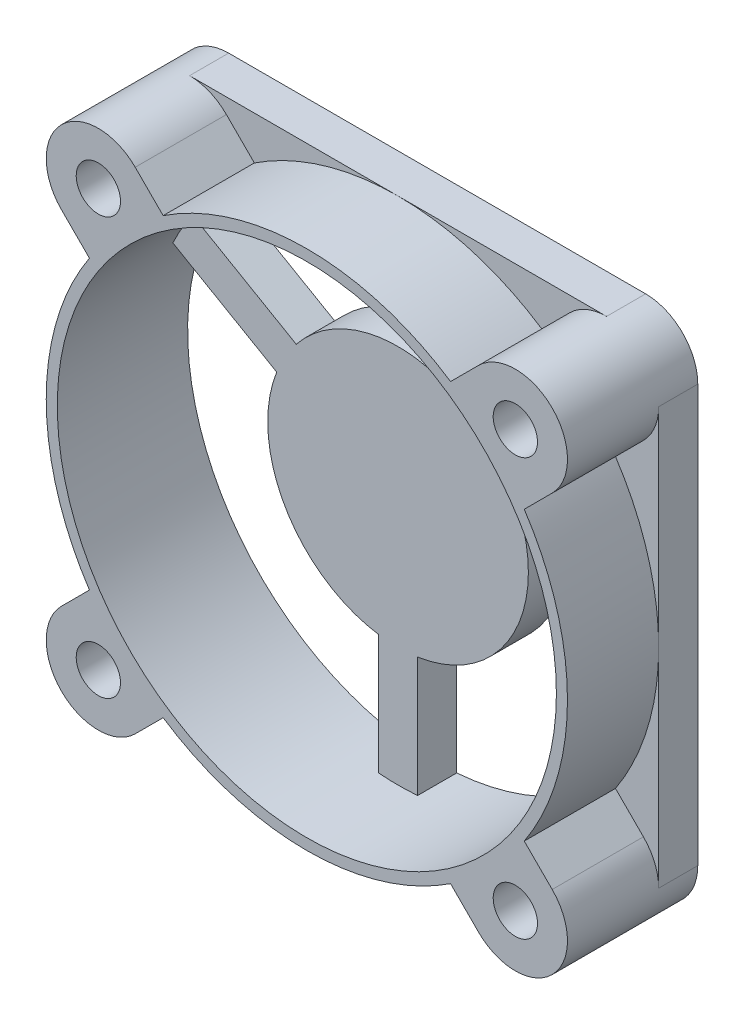
from build123d import *

# Parameters (mm, degrees)
SKETCH_BODY_R                       = 19.15
BODY_DEPTH                          = 10
SKETCH_CUT_BODY_W                   = 7
SKETCH_CUT_BODY_H                   = 6.627416998
REINFORCMENT_STRIP_DEPTH            = 10
CIRPATTERN_REINFORCMENT_STRIP_COUNT = 4
SKETCH_FIXING_HOLE_R                = 1.7
FIXING_HOLE_DEPTH                   = 31
CIRPATTERN_FIXING_HOLE_COUNT        = 4
BONE_DEPTH                          = 3
CIRPATTERN_BONE_COUNT               = 3
SKETCH_FIXING_PLATE_FAN_R           = 10
FIXING_PLATE_FAN_DEPTH              = 3


with BuildPart() as part:
    # Sketch-Body → Body (new body)
    with BuildSketch(Plane.XY):
        with BuildLine():
            Line((-16, -20), (16, -20))
            ThreePointArc((16, -20), (18.828427125, -18.828427125), (20, -16))
            Line((20, -16), (20, 16))
            ThreePointArc((20, 16), (18.828427125, 18.828427125), (16, 20))
            Line((16, 20), (-16, 20))
            ThreePointArc((-16, 20), (-18.828427125, 18.828427125), (-20, 16))
            Line((-20, 16), (-20, -16))
            ThreePointArc((-20, -16), (-18.828427125, -18.828427125), (-16, -20))
        make_face()
        with Locations(Location((0, 0, 0), (0, 0, 180))):
            Circle(SKETCH_BODY_R, mode=Mode.SUBTRACT)
    extrude(amount=BODY_DEPTH)

    # Sketch-Cut-Body → Cut-Body (revolve, cut)
    with BuildSketch(Plane(origin=(0, 0, 0), x_dir=(0, 0, -1), z_dir=(1, 0, 0)), mode=Mode.PRIVATE) as cut_body_sk:
        with Locations((-6.5, 23.313708499)):
            Rectangle(SKETCH_CUT_BODY_W, SKETCH_CUT_BODY_H)
    revolve(cut_body_sk.sketch.rotate(Axis((0, 0, 10), (0, 0, -1)), 90), axis=Axis((0, 0, 10), (0, 0, -1)), mode=Mode.SUBTRACT)

    # Sketch-Reinforcment-Strip → Reinforcment-Strip (add)
    with BuildSketch(Plane.XY):
        with BuildLine():
            Line((16.684833585, 11.027979336), (18.828427125, 13.171572875))
            ThreePointArc((18.828427125, 13.171572875), (18.828427125, 18.828427125), (13.171572875, 18.828427125))
            Line((13.171572875, 18.828427125), (11.027979336, 16.684833585))
            ThreePointArc((11.027979336, 16.684833585), (14.142135624, 14.142135624), (16.684833585, 11.027979336))
        make_face()
    reinforcment_strip = extrude(amount=REINFORCMENT_STRIP_DEPTH)

    # CirPattern-Reinforcment-Strip: Reinforcment-Strip ×4 about axis
    cirpattern_reinforcment_strip_axis = Axis((0, 0, 0), (0, 0, 1))
    for i in range(1, CIRPATTERN_REINFORCMENT_STRIP_COUNT):
        add(reinforcment_strip.rotate(cirpattern_reinforcment_strip_axis, i * 360 / CIRPATTERN_REINFORCMENT_STRIP_COUNT))

    # Sketch-Fixing-Hole → Fixing-Hole (cut, through all)
    with BuildSketch(Plane.XY):
        with Locations((16, 16)):
            Circle(SKETCH_FIXING_HOLE_R)
    fixing_hole = extrude(amount=FIXING_HOLE_DEPTH, mode=Mode.SUBTRACT)

    # CirPattern-Fixing-Hole: Fixing-Hole ×4 about axis
    cirpattern_fixing_hole_axis = Axis((0, 0, 0), (0, 0, 1))
    for i in range(1, CIRPATTERN_FIXING_HOLE_COUNT):
        add(fixing_hole.rotate(cirpattern_fixing_hole_axis, i * 360 / CIRPATTERN_FIXING_HOLE_COUNT), mode=Mode.SUBTRACT)

    # Sketch-Bone → Bone (add)
    with BuildSketch(Plane.XY):
        with BuildLine():
            Line((1.5, -9.886859967), (1.5, -19.091162877))
            ThreePointArc((1.5, -19.091162877), (0, -19.15), (-1.5, -19.091162877))
            Line((-1.5, -19.091162877), (-1.5, -9.886859967))
            ThreePointArc((-1.5, -9.886859967), (0, -10), (1.5, -9.886859967))
        make_face()
    bone = extrude(amount=BONE_DEPTH)

    # CirPattern-Bone: Bone ×3 about axis
    cirpattern_bone_axis = Axis((0, 0, 0), (0, 0, 1))
    for i in range(1, CIRPATTERN_BONE_COUNT):
        add(bone.rotate(cirpattern_bone_axis, i * 360 / CIRPATTERN_BONE_COUNT))

    # Sketch-Fixing-Plate-Fan → Fixing-Plate-Fan (add)
    with BuildSketch(Plane.XY):
        Circle(SKETCH_FIXING_PLATE_FAN_R)
    extrude(amount=FIXING_PLATE_FAN_DEPTH)


solid = part.part
